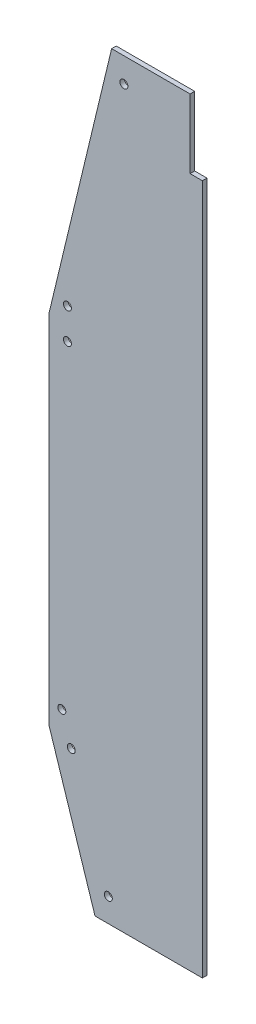
from build123d import *

# Parameters (mm, degrees)
BOSS_EXTRU_1_DEPTH      = 3
ESQUISSE2_R             = 2.6
ENL_V_MAT_EXTRU_1_DEPTH = 20


with BuildPart() as part:
    # Esquisse1 → Boss.-Extru.1 (new body)
    with BuildSketch(Plane.XY):
        Polygon((0, 450.3), (-8, 450.3), (-8, 495.3), (-59.18, 495.3), (-100, 325.5), (-100, 92.65), (-70, 0), (0, 0), align=None)
    extrude(amount=BOSS_EXTRU_1_DEPTH)

    # Esquisse2 → Enlèv. mat.-Extru.1 (cut)
    with BuildSketch(Plane(origin=(0, 0, 0), x_dir=(-1, 0, 0), z_dir=(0, 0, -1))):
        with Locations((61.335187385, 15.440747023)):
            Circle(ESQUISSE2_R)
        with Locations((85.503041698, 86.832938888)):
            Circle(ESQUISSE2_R)
        with Locations((91.66409495, 105.860325015)):
            Circle(ESQUISSE2_R)
        with Locations((88, 315.5)):
            Circle(ESQUISSE2_R)
        with Locations((88, 335.5)):
            Circle(ESQUISSE2_R)
        with Locations((51.165806832, 479.3)):
            Circle(ESQUISSE2_R)
    extrude(amount=-ENL_V_MAT_EXTRU_1_DEPTH, mode=Mode.SUBTRACT)


solid = part.part
